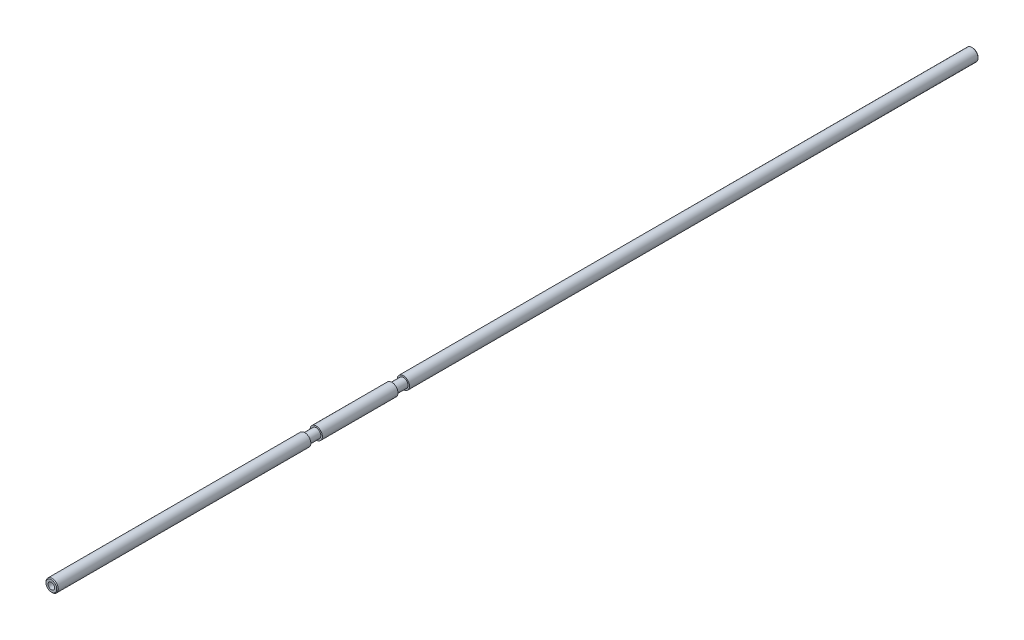
from build123d import *

# Parameters (mm, degrees)
BOSS_EXTRUDE1_START = 10
SKETCH1_R           = 8
BOSS_EXTRUDE1_DEPTH = 1200
CHAMFER1_SIZE       = 1
SKETCH2_R           = 4.25
CUT_EXTRUDE1_DEPTH  = 50
CUT_EXTRUDE2_START  = -50
SKETCH3_R           = 4.25
CUT_EXTRUDE2_DEPTH  = 50
CUT_EXTRUDE3_START  = -458.5
SKETCH4_R           = 8
SKETCH4_R_2         = 6
CUT_EXTRUDE3_DEPTH  = 15
CUT_EXTRUDE4_START  = -345
SKETCH4_2_R         = 8
SKETCH4_2_R_2       = 6
CUT_EXTRUDE4_DEPTH  = 15


with BuildPart() as part:
    # Sketch1 → Boss-Extrude1 (new body)
    with BuildSketch(Plane.XY.offset(BOSS_EXTRUDE1_START)):
        with Locations((-45, 0)):
            Circle(SKETCH1_R)
    extrude(amount=BOSS_EXTRUDE1_DEPTH)

    # Chamfer1
    chamfer1_edges = [part.edges().sort_by_distance(p)[0] for p in [
        (-53, 0, 1210),
        (-53, 0, 10),
    ]]
    chamfer(chamfer1_edges, length=CHAMFER1_SIZE)

    # Sketch2 → Cut-Extrude1 (cut)
    with BuildSketch(Plane.XY.offset(1210)):
        with Locations((-45, 0)):
            Circle(SKETCH2_R)
    extrude(amount=-CUT_EXTRUDE1_DEPTH, mode=Mode.SUBTRACT)

    # Sketch3 → Cut-Extrude2 (cut)
    with BuildSketch(Plane(origin=(0, 0, 10), x_dir=(-1, 0, 0), z_dir=(0, 0, -1)).offset(CUT_EXTRUDE2_START)):
        with Locations((45, 0)):
            Circle(SKETCH3_R)
    extrude(amount=CUT_EXTRUDE2_DEPTH, mode=Mode.SUBTRACT)

    # Sketch4 → Cut-Extrude3 (cut)
    with BuildSketch(Plane.XY.offset(1210).offset(CUT_EXTRUDE3_START)):
        with Locations((-45, 0)):
            Circle(SKETCH4_R)
        with Locations((-45, 0)):
            Circle(SKETCH4_R_2, mode=Mode.SUBTRACT)
    extrude(amount=CUT_EXTRUDE3_DEPTH, mode=Mode.SUBTRACT)

    # Sketch4<2> → Cut-Extrude4 (cut)
    with BuildSketch(Plane.XY.offset(1210).offset(CUT_EXTRUDE4_START)):
        with Locations((-45, 0)):
            Circle(SKETCH4_2_R)
        with Locations((-45, 0)):
            Circle(SKETCH4_2_R_2, mode=Mode.SUBTRACT)
    extrude(amount=CUT_EXTRUDE4_DEPTH, mode=Mode.SUBTRACT)


solid = part.part
